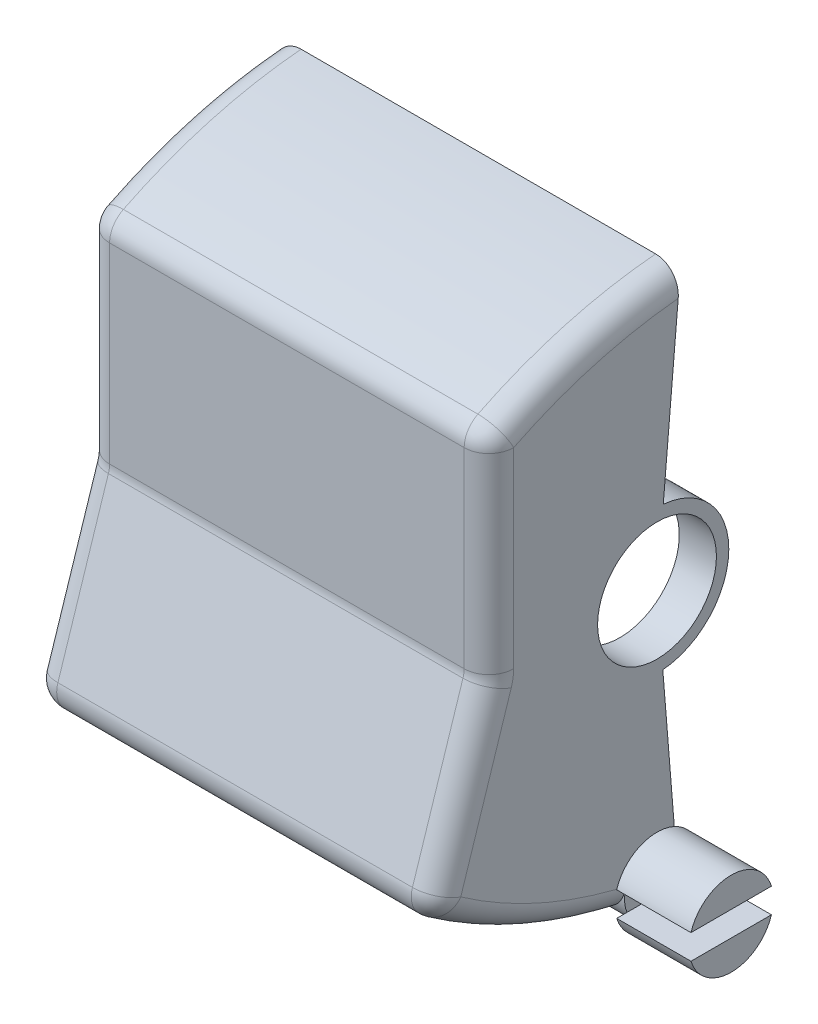
from build123d import *

# Parameters (mm, degrees)
Y_KSEKLIK_EKSTR_ZYON1_DEPTH = 8.16
BO_ALTMA1_T                 = -1.5
Y_KSEKLIK_EKSTR_ZYON6_START = -1.5
IZIM3_R                     = 2.9
IZIM3_R_2                   = 2.4
Y_KSEKLIK_EKSTR_ZYON6_DEPTH = 1.5
Y_KSEKLIK_EKSTR_ZYON8_START = -1.5
IZIM14_R                    = 2.9
IZIM14_R_2                  = 2.4
Y_KSEKLIK_EKSTR_ZYON8_DEPTH = 1.5
IZIM4_R                     = 1.306876714
Y_KSEKLIK_EKSTR_ZYON7_DEPTH = 1.5
RADYUS1_R                   = 1
IZIM15_R                    = 1.7
Y_KSEKLIK_EKSTR_ZYON9_DEPTH = 3
KES_EKSTR_ZYON1_START       = -3
KES_EKSTR_ZYON1_DEPTH       = 3
RADYUS2_R                   = 0.1


with BuildPart() as part:
    # Çizim1 → Yükseklik-Ekstrüzyon1 (new, symmetric)
    with BuildSketch(Plane(origin=(0, 0, 0), x_dir=(0, 0, -1), z_dir=(1, 0, 0))):
        with BuildLine():
            ThreePointArc((0.234441748, -2.890508098), (-2.899985447, 0.009187423), (0.252751654, 2.888964624))
            Line((0.252751654, 2.888964624), (0.945048542, 10.801954259))
            ThreePointArc((0.945048542, 10.801954259), (-3.03918883, 10.045066442), (-6.788828319, 8.5))
            Line((-6.788828319, 8.5), (-6.788828319, 0))
            Line((-6.788828319, 0), (-9.1, -7.135018252))
            ThreePointArc((-9.1, -7.135018252), (-4.371300658, -9.800569865), (0.9, -11.096390933))
            Line((0.9, -11.096390933), (0.234441748, -2.890508098))
        make_face()
    extrude(amount=Y_KSEKLIK_EKSTR_ZYON1_DEPTH, both=True)

    # İç Boşaltma1
    bo_altma1_openings = [part.faces().sort_by_distance(p)[0] for p in [
        (0, 6.845459442, -0.598900098),
        (0, 0.009187423, 2.899985447),
        (0, -6.993449516, -0.567220874),
    ]]
    offset(amount=BO_ALTMA1_T, openings=bo_altma1_openings, kind=Kind.INTERSECTION)

    # Çizim3 → Yükseklik-Ekstrüzyon6 (add)
    with BuildSketch(Plane.ZY.offset(-6.66).offset(Y_KSEKLIK_EKSTR_ZYON6_START)):
        Circle(IZIM3_R)
        Circle(IZIM3_R_2, mode=Mode.SUBTRACT)
    extrude(amount=Y_KSEKLIK_EKSTR_ZYON6_DEPTH)

    # Çizim14 → Yükseklik-Ekstrüzyon8 (add)
    with BuildSketch(Plane.ZY.offset(8.16).offset(Y_KSEKLIK_EKSTR_ZYON8_START)):
        Circle(IZIM14_R)
        Circle(IZIM14_R_2, mode=Mode.SUBTRACT)
    extrude(amount=Y_KSEKLIK_EKSTR_ZYON8_DEPTH)

    # Çizim4 → Yükseklik-Ekstrüzyon7 (add)
    with BuildSketch(Plane(origin=(8.16, 0, 0), x_dir=(0, 0, -1), z_dir=(1, 0, 0))):
        with Locations((-0.003711184, -10.152339642)):
            Circle(IZIM4_R)
    y_kseklik_ekstr_zyon7 = extrude(amount=-Y_KSEKLIK_EKSTR_ZYON7_DEPTH)

    # Aynalama2: Yükseklik-Ekstrüzyon7 across plane
    add(y_kseklik_ekstr_zyon7.mirror(Plane(origin=(0, 0, 0), x_dir=(0, 0, 1), z_dir=(1, 0, 0))))

    # Radyus1
    radyus1_edges = [part.edges().sort_by_distance(p)[0] for p in [
        (-8.16, -3.567509126, 7.94441416),
        (-8.16, 4.25, 6.788828319),
        (-8.16, 10.045066442, 3.03918883),
        (8.16, -3.567509126, 7.94441416),
        (0, -7.135018252, 9.1),
        (0, 0, 6.788828319),
        (0, 8.5, 6.788828319),
        (8.16, -9.392319843, 5.328384781),
        (8.16, 10.045066442, 3.03918883),
        (8.16, 4.25, 6.788828319),
        (-8.16, -9.392319843, 5.328384781),
    ]]
    fillet(radyus1_edges, radius=RADYUS1_R)

    # Çizim15 → Yükseklik-Ekstrüzyon9 (add)
    with BuildSketch(Plane(origin=(8.16, 0, 0), x_dir=(0, 0, -1), z_dir=(1, 0, 0))):
        with Locations(Location((-0.003711184, -10.152339642, 0), (0, 0, 162.33899623))):
            Circle(IZIM15_R)
    y_kseklik_ekstr_zyon9 = extrude(amount=Y_KSEKLIK_EKSTR_ZYON9_DEPTH)

    # Çizim16 → Kes-Ekstrüzyon1 (cut)
    with BuildSketch(Plane(origin=(11.16, 0, 0), x_dir=(0, 0, -1), z_dir=(1, 0, 0)).offset(KES_EKSTR_ZYON1_START)):
        with BuildLine():
            Line((1.621096497, -9.652339642), (-1.628518865, -9.652339642))
            ThreePointArc((-1.628518865, -9.652339642), (-1.703711184, -10.152339642), (-1.628518865, -10.652339642))
            Line((-1.628518865, -10.652339642), (1.621096497, -10.652339642))
            ThreePointArc((1.621096497, -10.652339642), (1.696288816, -10.152339642), (1.621096497, -9.652339642))
        make_face()
    kes_ekstr_zyon1 = extrude(amount=KES_EKSTR_ZYON1_DEPTH, mode=Mode.SUBTRACT)

    # Aynalama4: Yükseklik-Ekstrüzyon9, Kes-Ekstrüzyon1 across plane
    add(y_kseklik_ekstr_zyon9.mirror(Plane(origin=(0, 0, 0), x_dir=(0, 0, 1), z_dir=(1, 0, 0))))
    add(kes_ekstr_zyon1.mirror(Plane(origin=(0, 0, 0), x_dir=(0, 0, 1), z_dir=(1, 0, 0))), mode=Mode.SUBTRACT)

    # Radyus2
    radyus2_edges = [part.edges().sort_by_distance(p)[0] for p in [
        (0, -11.096390933, -0.9),
    ]]
    fillet(radyus2_edges, radius=RADYUS2_R)


solid = part.part
